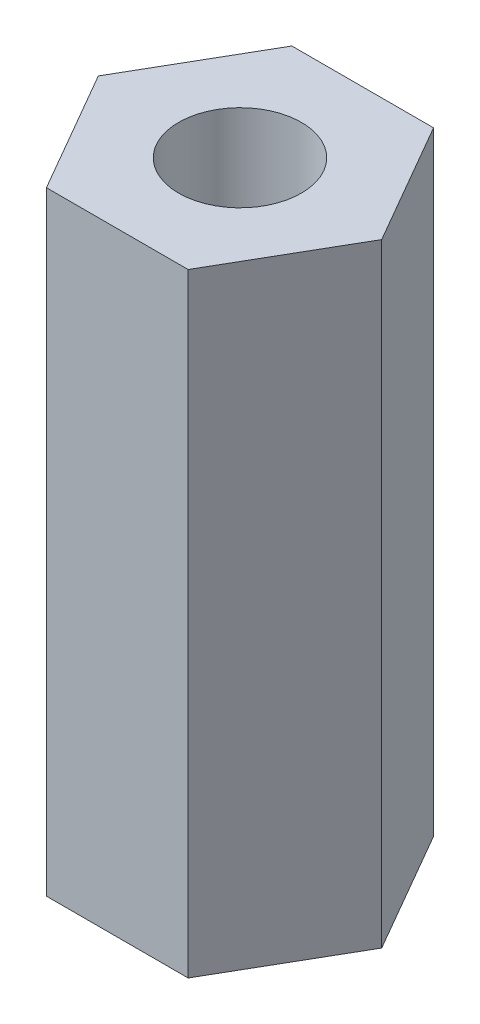
from build123d import *

# Parameters (mm, degrees)
SKETCH1_R           = 3.175
BOSS_EXTRUDE1_DEPTH = 31.75


with BuildPart() as part:
    # Sketch1 → Boss-Extrude1 (new body)
    with BuildSketch(Plane(origin=(0, 0, 0), x_dir=(1, 0, 0), z_dir=(0, 1, 0))):
        Polygon((7.332348419, 0), (3.666174209, 6.35), (-3.666174209, 6.35), (-7.332348419, 0), (-3.666174209, -6.35), (3.666174209, -6.35), align=None)
        with Locations(Location((0, 0, 0), (0, 0, 270))):
            Circle(SKETCH1_R, mode=Mode.SUBTRACT)
    extrude(amount=BOSS_EXTRUDE1_DEPTH)


solid = part.part
